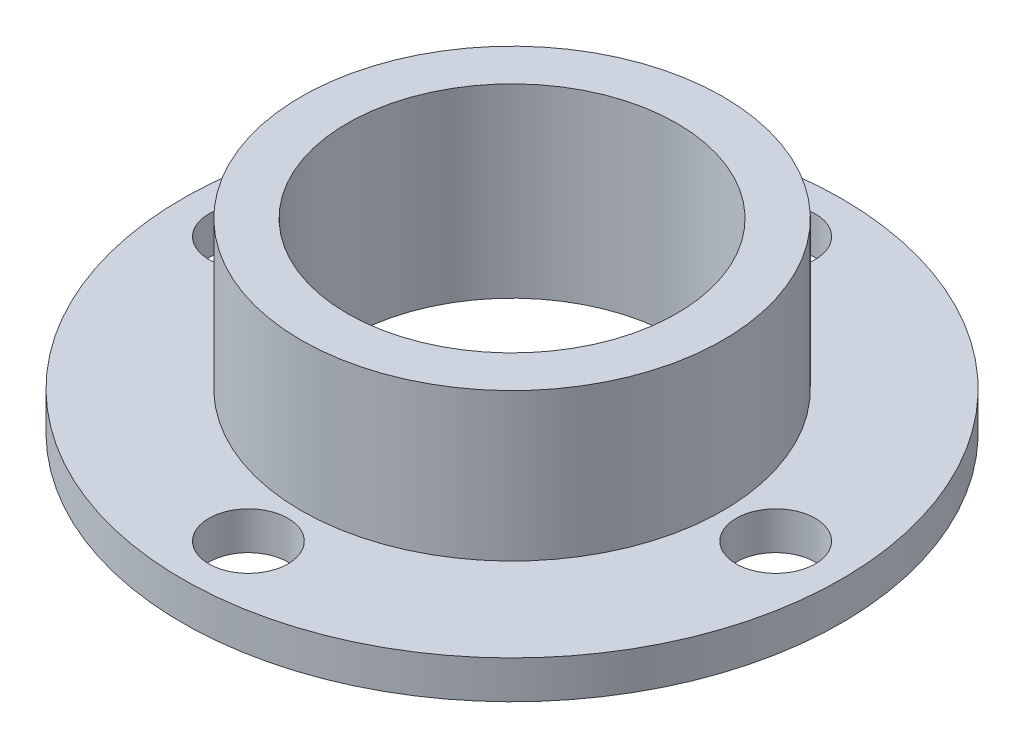
from build123d import *

# Parameters (mm, degrees)
SKETCH_1_R      = 12.5
SKETCH_1_R_2    = 6.25
SKETCH_1_R_3    = 1.5
EXTRUDE_1_DEPTH = 1.44
SKETCH_2_R      = 8
SKETCH_2_R_2    = 6.25
EXTRUDE_2_DEPTH = 5.6


with BuildPart() as part:
    # 草图1 → 凸台-拉伸1 (new body)
    with BuildSketch(Plane(origin=(0, 0, 0), x_dir=(1, 0, 0), z_dir=(0, 1, 0))):
        with Locations(Location((0, 0, 0), (0, 0, 90))):
            Circle(SKETCH_1_R)
        with Locations(Location((0, 0, 0), (0, 0, 90))):
            Circle(SKETCH_1_R_2, mode=Mode.SUBTRACT)
        with Locations(Location((0, 10, 0), (0, 0, 90))):
            Circle(SKETCH_1_R_3, mode=Mode.SUBTRACT)
        with Locations(Location((10, 0, 0), (0, 0, 90))):
            Circle(SKETCH_1_R_3, mode=Mode.SUBTRACT)
        with Locations(Location((0, -10, 0), (0, 0, 90))):
            Circle(SKETCH_1_R_3, mode=Mode.SUBTRACT)
        with Locations(Location((-10, 0, 0), (0, 0, 90))):
            Circle(SKETCH_1_R_3, mode=Mode.SUBTRACT)
    extrude(amount=EXTRUDE_1_DEPTH)

    # 草图2 → 凸台-拉伸2 (add)
    with BuildSketch(Plane(origin=(0, 1.44, 0), x_dir=(1, 0, 0), z_dir=(0, 1, 0))):
        with Locations(Location((0, 0, 0), (0, 0, 270))):
            Circle(SKETCH_2_R)
        with Locations(Location((0, 0, 0), (0, 0, 90))):
            Circle(SKETCH_2_R_2, mode=Mode.SUBTRACT)
    extrude(amount=EXTRUDE_2_DEPTH)


solid = part.part
